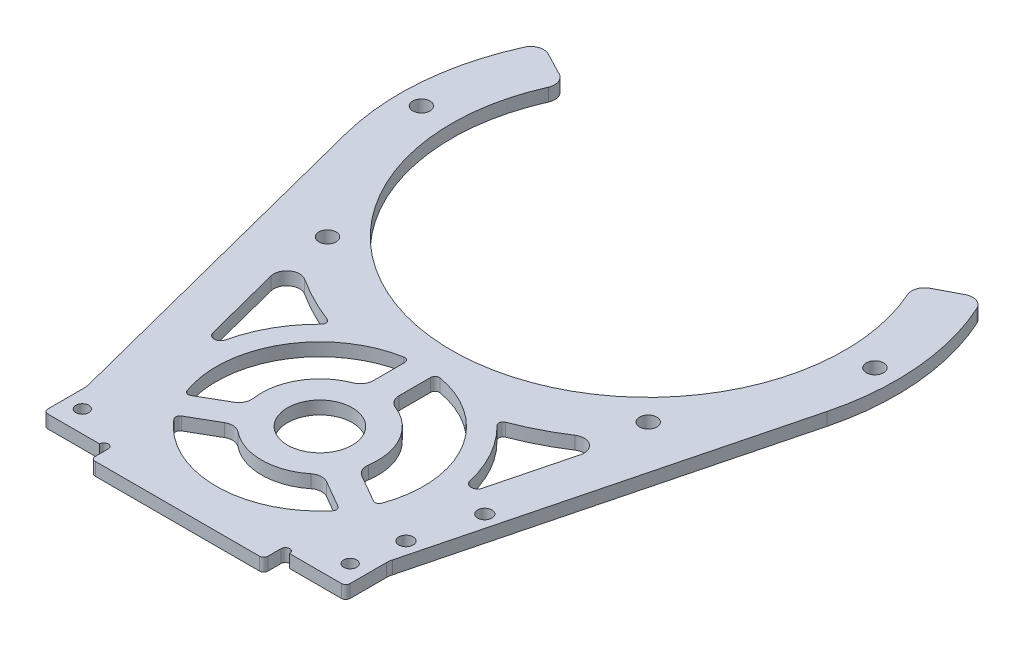
from build123d import *

# Parameters (mm, degrees)
SKETCH_1_R          = 1.5
SKETCH_1_R_2        = 2
SKETCH_1_R_3        = 1.65
EXTRUDE_1_DEPTH     = 3
SKETCH_3_R          = 1
CUT_EXTRUDE_3_DEPTH = 124.273070863
SKETCH_4_R          = 24
SKETCH_4_R_2        = 13.5
SKETCH_4_R_3        = 7.5
CUT_EXTRUDE_4_DEPTH = 124.273070863
SKETCH_5_W          = 6
SKETCH_5_H          = 16.5
EXTRUDE_1_2_DEPTH   = 3
FILLET_4_R          = 1
FILLET_6_R          = 5
FILLET_7_R          = 3


with BuildPart() as part:
    # 草图1 → Extrude 1 (new body)
    with BuildSketch(Plane(origin=(0, 0, 0), x_dir=(1, 0, 0), z_dir=(0, 1, 0))):
        with BuildLine():
            Line((-51.003122908, 26.550545261), (-40.35899291, 21.009561902))
            ThreePointArc((-40.35899291, 21.009561902), (0, -45.5), (40.35899291, 21.009561902))
            Line((40.35899291, 21.009561902), (51.003122908, 26.550545261))
            ThreePointArc((51.003122908, 26.550545261), (57.123657521, 6.567933576), (55.697982668, -14.282322175))
            Line((55.697982668, -14.282322175), (35, -95))
            Line((35, -95), (35, -105))
            Line((35, -105), (20, -105))
            Line((20, -105), (20, -109))
            Line((20, -109), (-20, -109))
            Line((-20, -109), (-20, -105))
            Line((-20, -105), (-35, -105))
            Line((-35, -105), (-35, -95))
            Line((-35, -95), (-55.697982668, -14.282322175))
            ThreePointArc((-55.697982668, -14.282322175), (-57.123657521, 6.567933576), (-51.003122908, 26.550545261))
        make_face()
        with Locations(Location((-31, -100, 0), (0, 0, 270))):
            Circle(SKETCH_1_R, mode=Mode.SUBTRACT)
        with Locations(Location((31, -100, 0), (0, 0, 90))):
            Circle(SKETCH_1_R, mode=Mode.SUBTRACT)
        with Locations(Location((-37.123106012, -37.123106012, 0), (0, 0, 270))):
            Circle(SKETCH_1_R_2, mode=Mode.SUBTRACT)
        with Locations(Location((-52.5, 0, 0), (0, 0, 270))):
            Circle(SKETCH_1_R_2, mode=Mode.SUBTRACT)
        with Locations(Location((52.5, 0, 0), (0, 0, 270))):
            Circle(SKETCH_1_R_2, mode=Mode.SUBTRACT)
        with Locations(Location((37.123106012, -37.123106012, 0), (0, 0, 270))):
            Circle(SKETCH_1_R_2, mode=Mode.SUBTRACT)
        with Locations(Location((32.925309654, -89, 0), (0, 0, 270))):
            Circle(SKETCH_1_R_3, mode=Mode.SUBTRACT)
        with Locations(Location((36.65113283, -74.470091478, 0), (0, 0, 270))):
            Circle(SKETCH_1_R_3, mode=Mode.SUBTRACT)
    extrude(amount=EXTRUDE_1_DEPTH)

    # 草图3 → 切除-拉伸3 (cut, through all)
    with BuildSketch(Plane(origin=(0, 3, 0), x_dir=(1, 0, 0), z_dir=(0, 1, 0))):
        with Locations((-21, -105)):
            Circle(SKETCH_3_R)
        with Locations((21, -105)):
            Circle(SKETCH_3_R)
    extrude(amount=-CUT_EXTRUDE_3_DEPTH, mode=Mode.SUBTRACT)

    # 草图4 → 切除-拉伸4 (cut, through all)
    # profile 1 of 4: a face of its own
    with BuildSketch(Plane(origin=(0, 3, 0), x_dir=(1, 0, 0), z_dir=(0, 1, 0))):
        with Locations(Location((0, -76, 0), (0, 0, 270))):
            Circle(SKETCH_4_R)
        with Locations(Location((0, -76, 0), (0, 0, 270))):
            Circle(SKETCH_4_R_2, mode=Mode.SUBTRACT)
    # profile 2 of 4: a face of its own
    with BuildSketch(Plane(origin=(0, 3, 0), x_dir=(1, 0, 0), z_dir=(0, 1, 0))):
        with Locations(Location((0, -76, 0), (0, 0, 270))):
            Circle(SKETCH_4_R_3)
    # profile 3 of 4: a face of its own
    with BuildSketch(Plane(origin=(0, 3, 0), x_dir=(1, 0, 0), z_dir=(0, 1, 0))):
        with BuildLine():
            Line((-35.830489881, -51.50170866), (-31.190656418, -69.59606059))
            ThreePointArc((-31.190656418, -69.59606059), (-29.717442346, -70.72334194), (-28.275157423, -69.556749833))
            ThreePointArc((-28.275157423, -69.556749833), (-24.920071276, -61.167938525), (-19.146204544, -54.21875))
            ThreePointArc((-19.146204544, -54.21875), (-25.395621297, -51.58790962), (-31.291887936, -48.239690602))
            ThreePointArc((-31.291887936, -48.239690602), (-34.67538019, -48.320471942), (-35.830489881, -51.50170866))
        make_face()
    # profile 4 of 4: a face of its own
    with BuildSketch(Plane(origin=(0, 3, 0), x_dir=(1, 0, 0), z_dir=(0, 1, 0))):
        with BuildLine():
            Line((35.830489881, -51.50170866), (31.190656418, -69.59606059))
            ThreePointArc((31.190656418, -69.59606059), (29.717442346, -70.72334194), (28.275157423, -69.556749833))
            ThreePointArc((28.275157423, -69.556749833), (24.920071276, -61.167938525), (19.146204544, -54.21875))
            ThreePointArc((19.146204544, -54.21875), (25.395621297, -51.58790962), (31.291887936, -48.239690602))
            ThreePointArc((31.291887936, -48.239690602), (34.67538019, -48.320471942), (35.830489881, -51.50170866))
        make_face()
    extrude(amount=-CUT_EXTRUDE_4_DEPTH, mode=Mode.SUBTRACT)


with BuildPart() as cut_extrude_4_piece_1:
    # of the separate pieces the step leaves, piece 1, a body of its own (cut_extrude_4_pieces)
    add(part.part.solids().sort_by_distance((-51.003122908, 0, -26.550545261))[0])



with BuildPart() as cut_extrude_4_piece_2:
    # of the separate pieces the step leaves, piece 2, a body of its own (cut_extrude_4_pieces)
    add(part.part.solids().sort_by_distance((0, 0, 89.5))[0])


with BuildPart() as cut_extrude_4_piece_1_1:
    add(cut_extrude_4_piece_1.part)

    add(cut_extrude_4_piece_2.part)  # Extrude 1 2 merges 切除-拉伸4 piece 2
    # 草图5 → Extrude 1 2 (add)
    with BuildSketch(Plane(origin=(0, 3, 0), x_dir=(1, 0, 0), z_dir=(0, 1, 0))):
        with Locations((0, -60.25)):
            Rectangle(SKETCH_5_W, SKETCH_5_H)
        Polygon((22.284609691, -85.401923789), (7.995190528, -77.151923789), (4.995190528, -82.348076211), (19.284609691, -90.598076211), align=None)
        Polygon((-19.284609691, -90.598076211), (-4.995190528, -82.348076211), (-7.995190528, -77.151923789), (-22.284609691, -85.401923789), align=None)
    extrude(amount=-EXTRUDE_1_2_DEPTH)

    # 圆角4
    fillet_4_edges = [cut_extrude_4_piece_1_1.edges().sort_by_distance(p)[0] for p in [
        (19.121590627, 1.5, 90.503957111),
        (22.121590627, 1.5, 85.307804688),
        (-19.146204544, 1.5, 54.21875),
        (19.146204544, 1.5, 54.21875),
        (-22.121590627, 1.5, 85.307804688),
        (-19.121590627, 1.5, 90.503957111),
        (3, 1.5, 52.1882382),
        (-3, 1.5, 52.1882382),
        (-35, 1.5, 105),
        (-20, 1.5, 109),
        (20, 1.5, 109),
        (35, 1.5, 105),
    ]]
    fillet(fillet_4_edges, radius=FILLET_4_R)

    # 圆角6
    fillet_6_edges = [cut_extrude_4_piece_1_1.edges().sort_by_distance(p)[0] for p in [
        (-35, 1.5, 95),
        (35, 1.5, 95),
    ]]
    fillet(fillet_6_edges, radius=FILLET_6_R)

    # 圆角7
    fillet_7_edges = [cut_extrude_4_piece_1_1.edges().sort_by_distance(p)[0] for p in [
        (9.899013115, 1.5, 85.179299502),
        (12.899013115, 1.5, 79.983147079),
        (-9.899013115, 1.5, 85.179299502),
        (-12.899013115, 1.5, 79.983147079),
        (51.003122908, 1.5, -26.550545261),
        (3, 1.5, 62.837553419),
        (40.35899291, 1.5, -21.009561902),
        (-40.35899291, 1.5, -21.009561902),
        (-3, 1.5, 62.837553419),
        (-51.003122908, 1.5, -26.550545261),
    ]]
    fillet(fillet_7_edges, radius=FILLET_7_R)


solid = cut_extrude_4_piece_1_1.part
